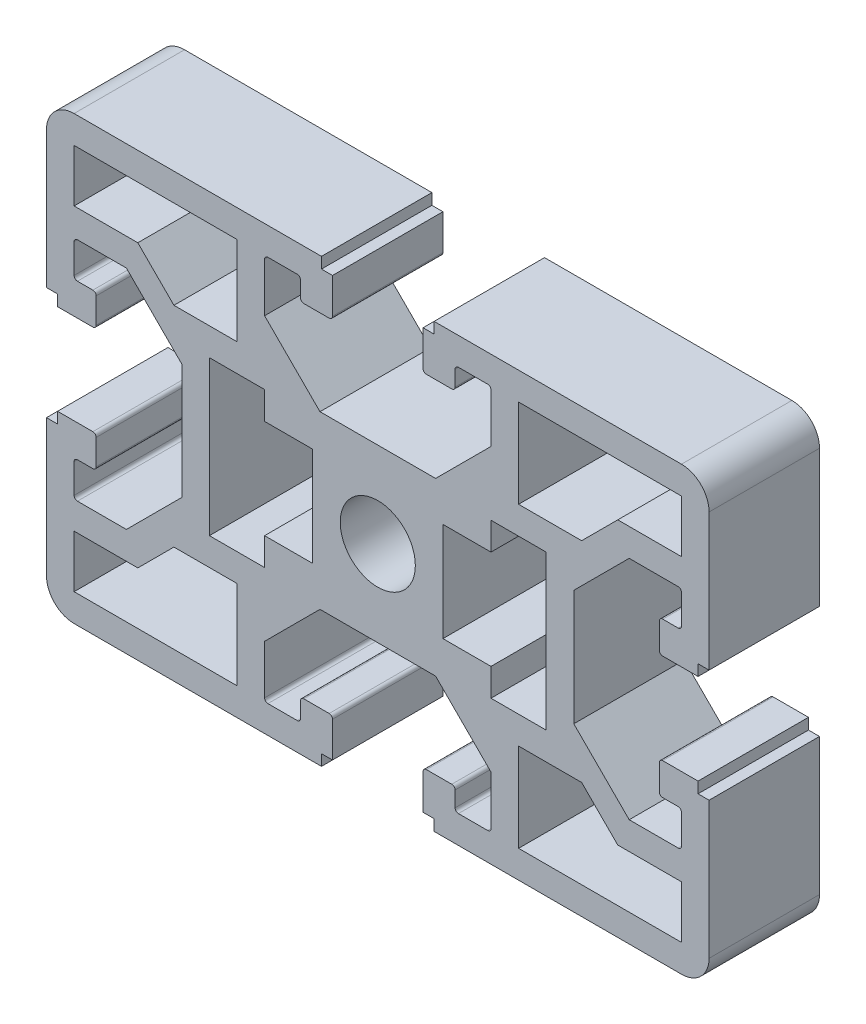
from build123d import *

# Parameters (mm, degrees)
SKETCH_1_R      = 3.4
EXTRUDE_1_DEPTH = 10


with BuildPart() as part:
    # 草图1 → 凸台-拉伸1 (new body)
    with BuildSketch(Plane.XY):
        with BuildLine():
            Line((-5.190537873, 20), (-27.590537873, 20))
            ThreePointArc((-27.590537873, 20), (-29.358304826, 19.267766953), (-30.090537873, 17.5))
            Line((-30.090537873, 17.5), (-30.090537873, 5.1))
            Line((-30.090537873, 5.1), (-29.090537873, 5.1))
            Line((-29.090537873, 5.1), (-29.090537873, 4.1))
            Line((-29.090537873, 4.1), (-25.890537873, 4.1))
            ThreePointArc((-25.890537873, 4.1), (-25.678405839, 4.187867966), (-25.590537873, 4.4))
            Line((-25.590537873, 4.4), (-25.590537873, 6.7))
            ThreePointArc((-25.590537873, 6.7), (-25.678405839, 6.912132034), (-25.890537873, 7))
            Line((-25.890537873, 7), (-27.290537873, 7))
            ThreePointArc((-27.290537873, 7), (-27.502669908, 7.087867966), (-27.590537873, 7.3))
            Line((-27.590537873, 7.3), (-27.590537873, 9.95))
            ThreePointArc((-27.590537873, 9.95), (-27.502669908, 10.162132034), (-27.290537873, 10.25))
            Line((-27.290537873, 10.25), (-22.856071779, 10.25))
            Line((-22.856071779, 10.25), (-17.840537873, 5.234466094))
            Line((-17.840537873, 5.234466094), (-17.840537873, 0))
            Line((-17.840537873, 0), (-17.840537873, -5.234466094))
            Line((-17.840537873, -5.234466094), (-22.856071779, -10.25))
            Line((-22.856071779, -10.25), (-27.290537873, -10.25))
            ThreePointArc((-27.290537873, -10.25), (-27.502669908, -10.162132034), (-27.590537873, -9.95))
            Line((-27.590537873, -9.95), (-27.590537873, -7.3))
            ThreePointArc((-27.590537873, -7.3), (-27.502669908, -7.087867966), (-27.290537873, -7))
            Line((-27.290537873, -7), (-25.890537873, -7))
            ThreePointArc((-25.890537873, -7), (-25.678405839, -6.912132034), (-25.590537873, -6.7))
            Line((-25.590537873, -6.7), (-25.590537873, -4.4))
            ThreePointArc((-25.590537873, -4.4), (-25.678405839, -4.187867966), (-25.890537873, -4.1))
            Line((-25.890537873, -4.1), (-29.090537873, -4.1))
            Line((-29.090537873, -4.1), (-29.090537873, -5.1))
            Line((-29.090537873, -5.1), (-30.090537873, -5.1))
            Line((-30.090537873, -5.1), (-30.090537873, -17.5))
            ThreePointArc((-30.090537873, -17.5), (-29.358304826, -19.267766953), (-27.590537873, -20))
            Line((-27.590537873, -20), (-5.190537873, -20))
            Line((-5.190537873, -20), (-5.190537873, -19))
            Line((-5.190537873, -19), (-4.190537873, -19))
            Line((-4.190537873, -19), (-4.190537873, -15.8))
            ThreePointArc((-4.190537873, -15.8), (-4.278405839, -15.587867966), (-4.490537873, -15.5))
            Line((-4.490537873, -15.5), (-6.790537873, -15.5))
            ThreePointArc((-6.790537873, -15.5), (-7.002669908, -15.587867966), (-7.090537873, -15.8))
            Line((-7.090537873, -15.8), (-7.090537873, -17.2))
            ThreePointArc((-7.090537873, -17.2), (-7.178405839, -17.412132034), (-7.390537873, -17.5))
            Line((-7.390537873, -17.5), (-10.040537873, -17.5))
            ThreePointArc((-10.040537873, -17.5), (-10.252669908, -17.412132034), (-10.340537873, -17.2))
            Line((-10.340537873, -17.2), (-10.340537873, -12.765533906))
            Line((-10.340537873, -12.765533906), (-5.325003967, -7.75))
            Line((-5.325003967, -7.75), (-0.090537873, -7.75))
            Line((-0.090537873, -7.75), (5.143928221, -7.75))
            Line((5.143928221, -7.75), (10.159462127, -12.765533906))
            Line((10.159462127, -12.765533906), (10.159462127, -17.2))
            ThreePointArc((10.159462127, -17.2), (10.071594161, -17.412132034), (9.859462127, -17.5))
            Line((9.859462127, -17.5), (7.209462127, -17.5))
            ThreePointArc((7.209462127, -17.5), (6.997330092, -17.412132034), (6.909462127, -17.2))
            Line((6.909462127, -17.2), (6.909462127, -15.8))
            ThreePointArc((6.909462127, -15.8), (6.821594161, -15.587867966), (6.609462127, -15.5))
            Line((6.609462127, -15.5), (4.309462127, -15.5))
            ThreePointArc((4.309462127, -15.5), (4.097330092, -15.587867966), (4.009462127, -15.8))
            Line((4.009462127, -15.8), (4.009462127, -19))
            Line((4.009462127, -19), (5.009462127, -19))
            Line((5.009462127, -19), (5.009462127, -20))
            Line((5.009462127, -20), (27.409462127, -20))
            ThreePointArc((27.409462127, -20), (29.17722908, -19.267766953), (29.909462127, -17.5))
            Line((29.909462127, -17.5), (29.909462127, -5.1))
            Line((29.909462127, -5.1), (28.909462127, -5.1))
            Line((28.909462127, -5.1), (28.909462127, -4.1))
            Line((28.909462127, -4.1), (25.709462127, -4.1))
            ThreePointArc((25.709462127, -4.1), (25.497330092, -4.187867966), (25.409462127, -4.4))
            Line((25.409462127, -4.4), (25.409462127, -6.7))
            ThreePointArc((25.409462127, -6.7), (25.497330092, -6.912132034), (25.709462127, -7))
            Line((25.709462127, -7), (27.109462127, -7))
            ThreePointArc((27.109462127, -7), (27.321594161, -7.087867966), (27.409462127, -7.3))
            Line((27.409462127, -7.3), (27.409462127, -9.95))
            ThreePointArc((27.409462127, -9.95), (27.321594161, -10.162132034), (27.109462127, -10.25))
            Line((27.109462127, -10.25), (22.674996033, -10.25))
            Line((22.674996033, -10.25), (17.659462127, -5.234466094))
            Line((17.659462127, -5.234466094), (17.659462127, 0))
            Line((17.659462127, 0), (17.659462127, 5.234466094))
            Line((17.659462127, 5.234466094), (22.674996033, 10.25))
            Line((22.674996033, 10.25), (27.109462127, 10.25))
            ThreePointArc((27.109462127, 10.25), (27.321594161, 10.162132034), (27.409462127, 9.95))
            Line((27.409462127, 9.95), (27.409462127, 7.3))
            ThreePointArc((27.409462127, 7.3), (27.321594161, 7.087867966), (27.109462127, 7))
            Line((27.109462127, 7), (25.709462127, 7))
            ThreePointArc((25.709462127, 7), (25.497330092, 6.912132034), (25.409462127, 6.7))
            Line((25.409462127, 6.7), (25.409462127, 4.4))
            ThreePointArc((25.409462127, 4.4), (25.497330092, 4.187867966), (25.709462127, 4.1))
            Line((25.709462127, 4.1), (28.909462127, 4.1))
            Line((28.909462127, 4.1), (28.909462127, 5.1))
            Line((28.909462127, 5.1), (29.909462127, 5.1))
            Line((29.909462127, 5.1), (29.909462127, 17.5))
            ThreePointArc((29.909462127, 17.5), (29.17722908, 19.267766953), (27.409462127, 20))
            Line((27.409462127, 20), (5.009462127, 20))
            Line((5.009462127, 20), (5.009462127, 19))
            Line((5.009462127, 19), (4.009462127, 19))
            Line((4.009462127, 19), (4.009462127, 15.8))
            ThreePointArc((4.009462127, 15.8), (4.097330092, 15.587867966), (4.309462127, 15.5))
            Line((4.309462127, 15.5), (6.609462127, 15.5))
            ThreePointArc((6.609462127, 15.5), (6.821594161, 15.587867966), (6.909462127, 15.8))
            Line((6.909462127, 15.8), (6.909462127, 17.2))
            ThreePointArc((6.909462127, 17.2), (6.997330092, 17.412132034), (7.209462127, 17.5))
            Line((7.209462127, 17.5), (9.859462127, 17.5))
            ThreePointArc((9.859462127, 17.5), (10.071594161, 17.412132034), (10.159462127, 17.2))
            Line((10.159462127, 17.2), (10.159462127, 12.765533906))
            Line((10.159462127, 12.765533906), (5.143928221, 7.75))
            Line((5.143928221, 7.75), (-0.090537873, 7.75))
            Line((-0.090537873, 7.75), (-5.325003967, 7.75))
            Line((-5.325003967, 7.75), (-10.340537873, 12.765533906))
            Line((-10.340537873, 12.765533906), (-10.340537873, 17.2))
            ThreePointArc((-10.340537873, 17.2), (-10.252669908, 17.412132034), (-10.040537873, 17.5))
            Line((-10.040537873, 17.5), (-7.390537873, 17.5))
            ThreePointArc((-7.390537873, 17.5), (-7.178405839, 17.412132034), (-7.090537873, 17.2))
            Line((-7.090537873, 17.2), (-7.090537873, 15.8))
            ThreePointArc((-7.090537873, 15.8), (-7.002669908, 15.587867966), (-6.790537873, 15.5))
            Line((-6.790537873, 15.5), (-4.490537873, 15.5))
            ThreePointArc((-4.490537873, 15.5), (-4.278405839, 15.587867966), (-4.190537873, 15.8))
            Line((-4.190537873, 15.8), (-4.190537873, 19))
            Line((-4.190537873, 19), (-5.190537873, 19))
            Line((-5.190537873, 19), (-5.190537873, 20))
        make_face()
        with Locations((-0.090537873, 0)):
            Circle(SKETCH_1_R, mode=Mode.SUBTRACT)
        Polygon((-12.840537873, 17.5), (-27.590537873, 17.5), (-27.590537873, 12.75), (-21.820537873, 12.75), (-18.550537873, 9.48), (-12.840537873, 9.48), (-12.840537873, 10.25), (-12.840537873, 12.75), align=None, mode=Mode.SUBTRACT)
        Polygon((-15.340537873, 6.98), (-15.340537873, 0), (-15.340537873, -6.98), (-10.340537873, -6.98), (-10.340537873, -4.48), (-5.990537873, -4.48), (-5.990537873, 0), (-5.990537873, 4.48), (-10.340537873, 4.48), (-10.340537873, 6.98), align=None, mode=Mode.SUBTRACT)
        Polygon((12.659462127, 17.5), (27.409462127, 17.5), (27.409462127, 12.75), (21.639462127, 12.75), (18.369462127, 9.48), (12.659462127, 9.48), (12.659462127, 10.25), (12.659462127, 12.75), align=None, mode=Mode.SUBTRACT)
        Polygon((15.159462127, 6.98), (15.159462127, 0), (15.159462127, -6.98), (10.159462127, -6.98), (10.159462127, -4.48), (5.809462127, -4.48), (5.809462127, 0), (5.809462127, 4.48), (10.159462127, 4.48), (10.159462127, 6.98), align=None, mode=Mode.SUBTRACT)
        Polygon((-12.840537873, -17.5), (-27.590537873, -17.5), (-27.590537873, -12.75), (-21.820537873, -12.75), (-18.550537873, -9.48), (-12.840537873, -9.48), (-12.840537873, -10.25), (-12.840537873, -12.75), align=None, mode=Mode.SUBTRACT)
        Polygon((12.659462127, -17.5), (27.409462127, -17.5), (27.409462127, -12.75), (21.639462127, -12.75), (18.369462127, -9.48), (12.659462127, -9.48), (12.659462127, -10.25), (12.659462127, -12.75), align=None, mode=Mode.SUBTRACT)
    extrude(amount=EXTRUDE_1_DEPTH)


solid = part.part
